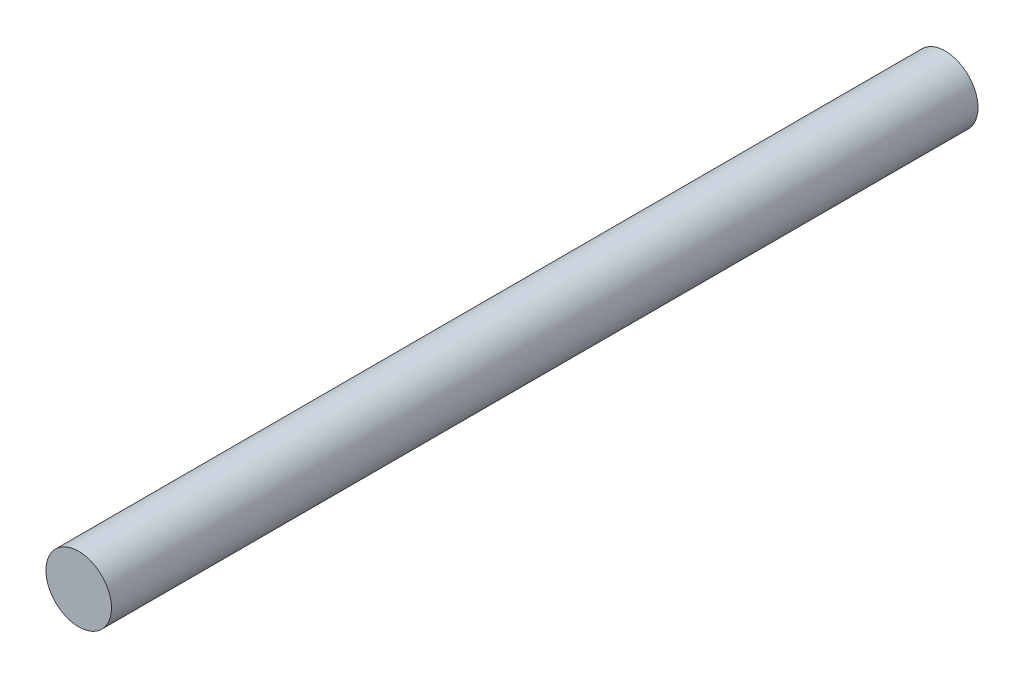
from build123d import *

# Parameters (mm, degrees)
SKETCH3_R           = 7.45
BOSS_EXTRUDE1_DEPTH = 197


with BuildPart() as part:
    # Sketch3 → Boss-Extrude1 (new body)
    with BuildSketch(Plane.XY):
        Circle(SKETCH3_R)
    extrude(amount=BOSS_EXTRUDE1_DEPTH)


solid = part.part
